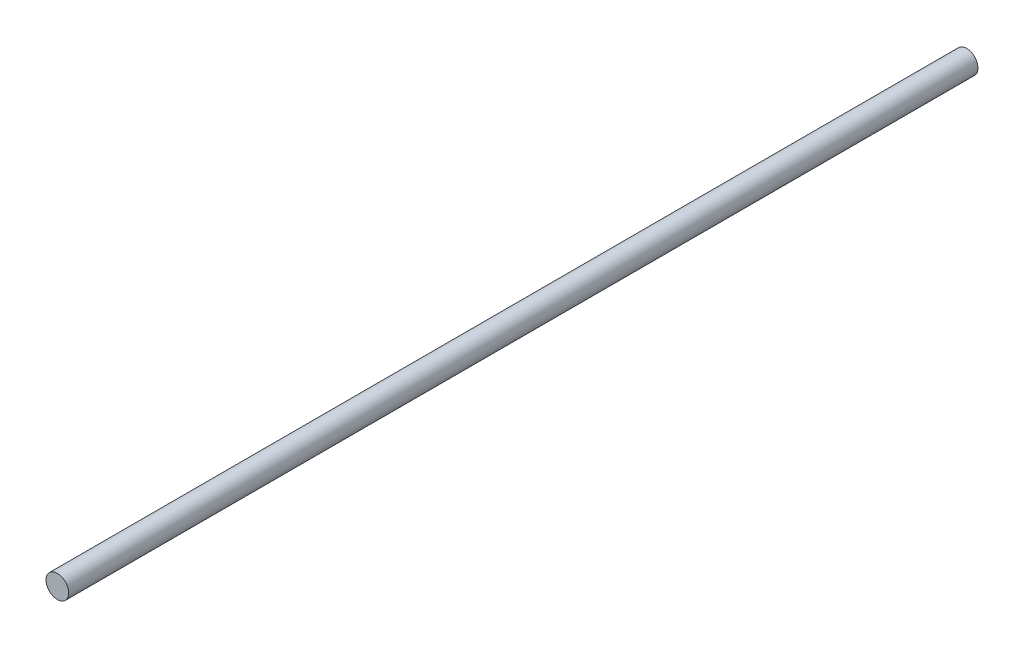
from build123d import *

# Parameters (mm, degrees)
ESQUISSE1_R        = 2.5
BOSS_EXTRU_1_DEPTH = 200


with BuildPart() as part:
    # Esquisse1 → Boss.-Extru.1 (new body)
    with BuildSketch(Plane.XY):
        Circle(ESQUISSE1_R)
    extrude(amount=BOSS_EXTRU_1_DEPTH)


solid = part.part
